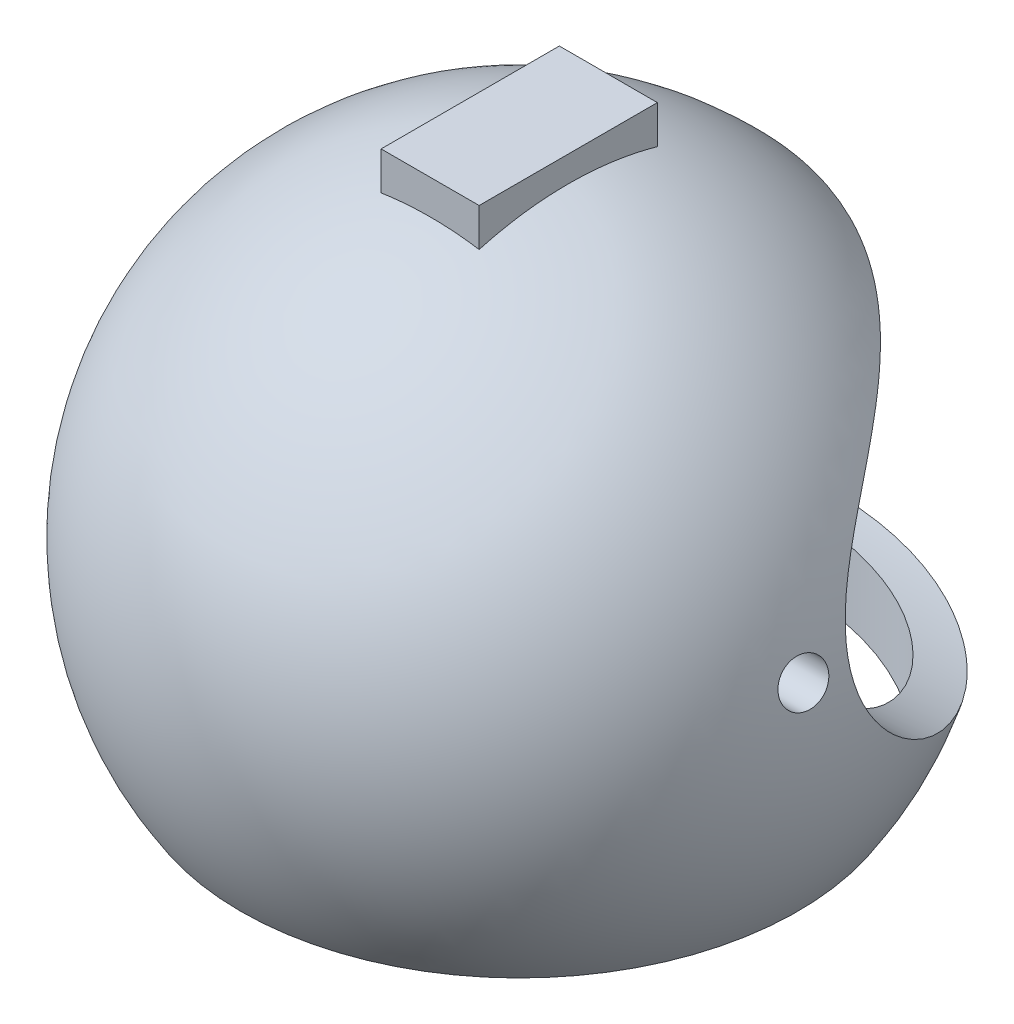
from build123d import *

# Parameters (mm, degrees)
CUT_EXTRUDE2_DEPTH      = 40
CUT_EXTRUDE2_DEPTH_BACK = 75
SKETCH2_R               = 62.5
CUT_EXTRUDE4_DEPTH      = 130.903810568
CUT_EXTRUDE4_DEPTH_BACK = 130.903810568
SKETCH6_W               = 22
SKETCH6_H               = 40
BOSS_EXTRUDE1_DEPTH     = 5
CUT_EXTRUDE5_DEPTH      = 133.853302556
CUT_EXTRUDE5_DEPTH_BACK = 133.853302556
SKETCH8_R               = 5


with BuildPart() as part:
    # Sketch1 → Revolve1 (revolve)
    with BuildSketch(Plane.XY):
        with BuildLine():
            Line((0, 75), (0, -75))
            ThreePointArc((0, -75), (-75, 0), (0, 75))
        make_face()
    revolve(axis=Axis((0, 124.688842105, 0), (0, -1, 0)))

    # Sketch2 → Cut-Extrude2 (cut, two sides: drawn at the far end of the back side and taken through both)
    with BuildSketch(Plane(origin=(0, 0, 0), x_dir=(1, 0, 0), z_dir=(0, 1, 0)).offset(-CUT_EXTRUDE2_DEPTH_BACK)):
        with Locations(Location((0, 0, 0), (0, 0, 270))):
            Circle(SKETCH2_R)
    extrude(amount=CUT_EXTRUDE2_DEPTH + CUT_EXTRUDE2_DEPTH_BACK, mode=Mode.SUBTRACT)

    # Sketch3 → Cut-Extrude4 (cut, two sides: drawn at the far end of the back side and taken through both)
    with BuildSketch(Plane(origin=(0, 0, 0), x_dir=(0, 0, -1), z_dir=(1, 0, 0)).offset(-CUT_EXTRUDE4_DEPTH_BACK)):
        with BuildLine():
            ThreePointArc((70.281956591, -26.181034696), (73.381820705, 15.495431263), (53.696962514, 52.360636137))
            add(Edge.make_bspline(
                [(53.696962514, 52.360636137), (-6.667727446, 43.107629562), (0.48026113, 9.256850763), (7.628249706, -24.593928036), (70.281956591, -26.181034696)],
                knots=[4.987408854, 4.987408854, 4.987408854, 6.397396854, 6.397396854, 7.807384853, 7.807384853, 7.807384853], degree=2, weights=[1, 0.76161544, 1, 0.76161544, 1]))
        make_face()
    extrude(amount=CUT_EXTRUDE4_DEPTH + CUT_EXTRUDE4_DEPTH_BACK, mode=Mode.SUBTRACT)

    # Sketch6 → Boss-Extrude1 (add, symmetric)
    with BuildSketch(Plane(origin=(0, 75, 0), x_dir=(1, 0, 0), z_dir=(0, 1, 0))):
        Rectangle(SKETCH6_W, SKETCH6_H)
    extrude(amount=BOSS_EXTRUDE1_DEPTH, both=True)

    # Sketch8 → Cut-Extrude5 (cut, two sides: drawn at the far end of the back side and taken through both)
    with BuildSketch(Plane(origin=(0, 0, 0), x_dir=(0, 0, -1), z_dir=(1, 0, 0)).offset(-CUT_EXTRUDE5_DEPTH_BACK)):
        with Locations((-9.331175984, 12.950127065)):
            Circle(SKETCH8_R)
    extrude(amount=CUT_EXTRUDE5_DEPTH + CUT_EXTRUDE5_DEPTH_BACK, mode=Mode.SUBTRACT)


solid = part.part
